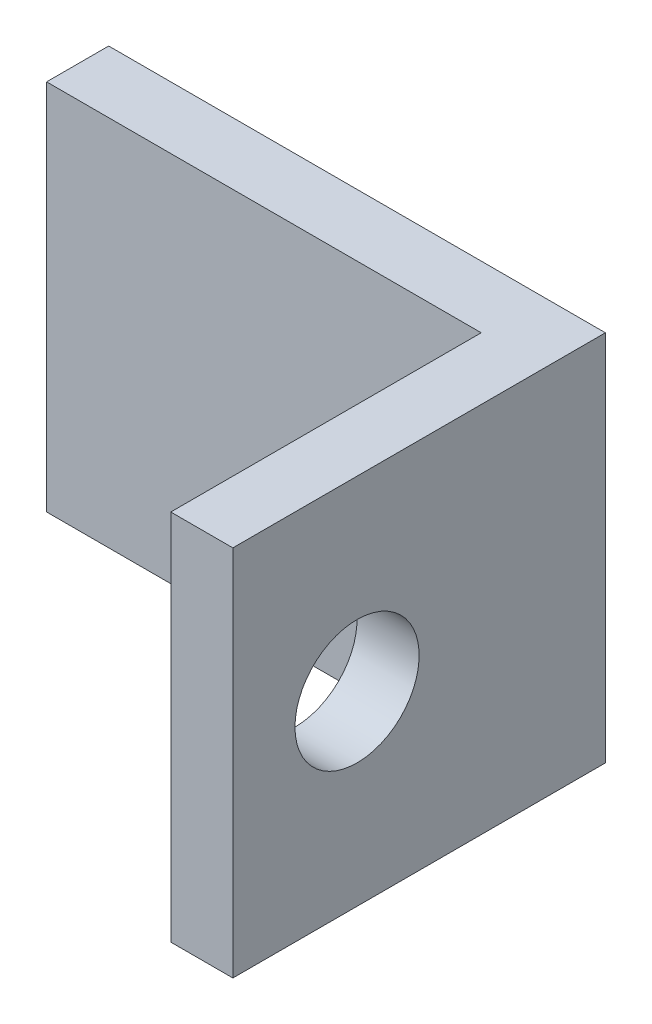
from build123d import *

# Parameters (mm, degrees)
BOSS_EXTRUDE1_DEPTH          = 9.525
F_1_8_0_125_DIAMETER_HOLE1_D = 3.175


with BuildPart() as part:
    # Sketch1 → Boss-Extrude1 (new body)
    with BuildSketch(Plane(origin=(0, 0, 0), x_dir=(1, 0, 0), z_dir=(0, 1, 0))):
        Polygon((0, 0), (12.7, 0), (12.7, -9.525), (11.1125, -9.525), (11.1125, -1.5875), (0, -1.5875), align=None)
    extrude(amount=BOSS_EXTRUDE1_DEPTH)

    # 1/8 (0.125) Diameter Hole1 (through all)
    with Locations(Plane.ZY.offset(-11.1125)):
        with Locations((6.35, 4.7625)):
            Hole(F_1_8_0_125_DIAMETER_HOLE1_D / 2)


solid = part.part
